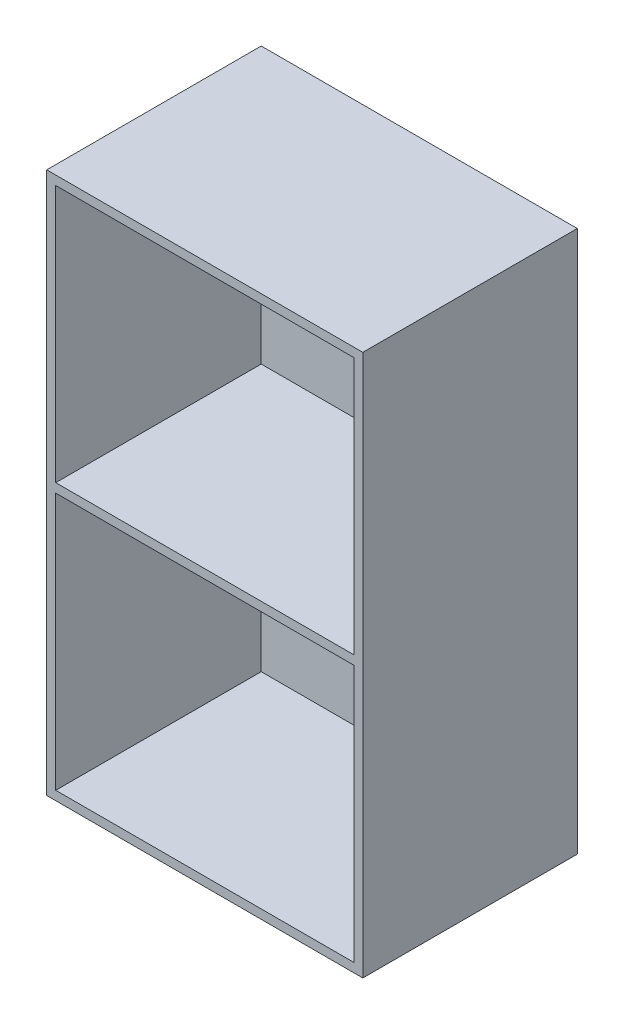
from build123d import *

# Parameters (mm, degrees)
SKETCH_1_W      = 420
SKETCH_1_H      = 720
EXTRUDE_1_DEPTH = 12
SKETCH_2_W      = 420
SKETCH_2_H      = 720
SKETCH_2_W_2    = 396
SKETCH_2_H_2    = 342
EXTRUDE_2_DEPTH = 273


with BuildPart() as part:
    # ｽｹｯﾁ1 → ﾎﾞｽ - 押し出し1 (new body)
    with BuildSketch(Plane.XY):
        Rectangle(SKETCH_1_W, SKETCH_1_H)
    extrude(amount=EXTRUDE_1_DEPTH)

    # ｽｹｯﾁ2 → ﾎﾞｽ - 押し出し2 (add)
    with BuildSketch(Plane.XY.offset(12)):
        Rectangle(SKETCH_2_W, SKETCH_2_H)
        with Locations((0, 177)):
            Rectangle(SKETCH_2_W_2, SKETCH_2_H_2, mode=Mode.SUBTRACT)
        with Locations((0, -177)):
            Rectangle(SKETCH_2_W_2, SKETCH_2_H_2, mode=Mode.SUBTRACT)
    extrude(amount=EXTRUDE_2_DEPTH)


solid = part.part
